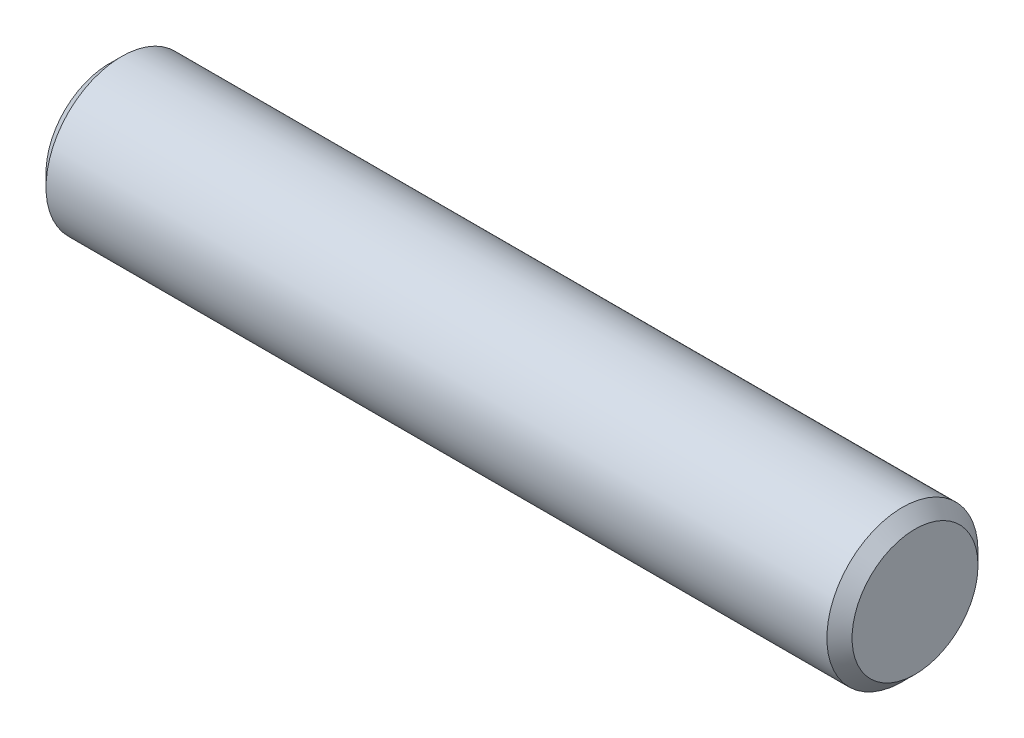
from build123d import *

# Parameters (mm, degrees)
SKETCH2_R           = 3
BOSS_EXTRUDE1_DEPTH = 16
CHAMFER1_SIZE       = 0.5


with BuildPart() as part:
    # Sketch2 → Boss-Extrude1 (new, symmetric)
    with BuildSketch(Plane(origin=(0, 0, 0), x_dir=(0, 0, -1), z_dir=(1, 0, 0))):
        Circle(SKETCH2_R)
    extrude(amount=BOSS_EXTRUDE1_DEPTH, both=True)

    # Chamfer1
    chamfer1_edges = [part.edges().sort_by_distance(p)[0] for p in [
        (-16, 0, 3),
        (16, 0, 3),
    ]]
    chamfer(chamfer1_edges, length=CHAMFER1_SIZE)


solid = part.part
